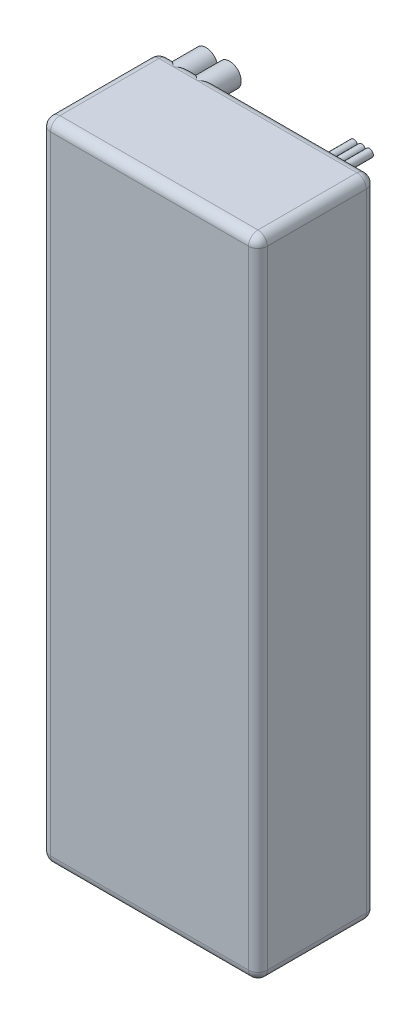
from build123d import *

# Parameters (mm, degrees)
SKETCH1_W                       = 46
SKETCH1_H                       = 137
BOSS_EXTRUDE1_DEPTH             = 25
FILLET1_R                       = 2
SKETCH2_R                       = 0.825
SKETCH2_R_2                     = 2.45
BOSS_EXTRUDE4_DEPTH             = 5
BOSS_EXTRUDE4_DIRECTION_2_REACH = 143.149


with BuildPart() as part:
    # Sketch1 → Boss-Extrude1 (new body)
    with BuildSketch(Plane.XY):
        with Locations((0, 68.5)):
            Rectangle(SKETCH1_W, SKETCH1_H)
    extrude(amount=BOSS_EXTRUDE1_DEPTH)

    # Fillet1
    fillet1_edges = [part.edges().sort_by_distance(p)[0] for p in [
        (23, 68.5, 25),
        (0, 137, 25),
        (-23, 68.5, 25),
        (0, 137, 0),
        (23, 68.5, 0),
        (0, 0, 0),
        (-23, 68.5, 0),
        (-23, 137, 12.5),
        (23, 137, 12.5),
        (23, 0, 12.5),
        (-23, 0, 12.5),
        (0, 0, 25),
    ]]
    fillet(fillet1_edges, radius=FILLET1_R)

    # Sketch2 → Boss-Extrude4 (add)
    with BuildSketch(Plane(origin=(0, 0, 0), x_dir=(-1, 0, 0), z_dir=(0, 0, -1))):
        with Locations((-16.666666667, 135)):
            Circle(SKETCH2_R)
        with Locations((-15, 135)):
            Circle(SKETCH2_R)
        with Locations((-13.333333333, 135)):
            Circle(SKETCH2_R)
        with Locations((13, 134.55)):
            Circle(SKETCH2_R_2)
        with Locations((18, 134.55)):
            Circle(SKETCH2_R_2)
    extrude(amount=BOSS_EXTRUDE4_DEPTH)

    # Sketch2 → Boss-Extrude4 direction 2 (add, up to next)
    with BuildSketch(Plane(origin=(0, 0, 0), x_dir=(-1, 0, 0), z_dir=(0, 0, -1)), mode=Mode.PRIVATE) as boss_extrude4_direction_2_sk1:
        with Locations((-16.666666667, 135)):
            Circle(SKETCH2_R)
    boss_extrude4_direction_2_tool1 = extrude(boss_extrude4_direction_2_sk1.sketch, amount=-BOSS_EXTRUDE4_DIRECTION_2_REACH, mode=Mode.PRIVATE) - part.part
    # Sketch2 → Boss-Extrude4 direction 2 (add, up to next)
    with BuildSketch(Plane(origin=(0, 0, 0), x_dir=(-1, 0, 0), z_dir=(0, 0, -1)), mode=Mode.PRIVATE) as boss_extrude4_direction_2_sk2:
        with Locations((-15, 135)):
            Circle(SKETCH2_R)
    boss_extrude4_direction_2_tool2 = extrude(boss_extrude4_direction_2_sk2.sketch, amount=-BOSS_EXTRUDE4_DIRECTION_2_REACH, mode=Mode.PRIVATE) - part.part
    # Sketch2 → Boss-Extrude4 direction 2 (add, up to next)
    with BuildSketch(Plane(origin=(0, 0, 0), x_dir=(-1, 0, 0), z_dir=(0, 0, -1)), mode=Mode.PRIVATE) as boss_extrude4_direction_2_sk3:
        with Locations((-13.333333333, 135)):
            Circle(SKETCH2_R)
    boss_extrude4_direction_2_tool3 = extrude(boss_extrude4_direction_2_sk3.sketch, amount=-BOSS_EXTRUDE4_DIRECTION_2_REACH, mode=Mode.PRIVATE) - part.part
    # Sketch2 → Boss-Extrude4 direction 2 (add, up to next)
    with BuildSketch(Plane(origin=(0, 0, 0), x_dir=(-1, 0, 0), z_dir=(0, 0, -1)), mode=Mode.PRIVATE) as boss_extrude4_direction_2_sk4:
        with Locations((13, 134.55)):
            Circle(SKETCH2_R_2)
    boss_extrude4_direction_2_tool4 = extrude(boss_extrude4_direction_2_sk4.sketch, amount=-BOSS_EXTRUDE4_DIRECTION_2_REACH, mode=Mode.PRIVATE) - part.part
    # Sketch2 → Boss-Extrude4 direction 2 (add, up to next)
    with BuildSketch(Plane(origin=(0, 0, 0), x_dir=(-1, 0, 0), z_dir=(0, 0, -1)), mode=Mode.PRIVATE) as boss_extrude4_direction_2_sk5:
        with Locations((18, 134.55)):
            Circle(SKETCH2_R_2)
    boss_extrude4_direction_2_tool5 = extrude(boss_extrude4_direction_2_sk5.sketch, amount=-BOSS_EXTRUDE4_DIRECTION_2_REACH, mode=Mode.PRIVATE) - part.part
    add(boss_extrude4_direction_2_tool1.solids().sort_by_distance((16.666667, 135, 0))[0])
    add(boss_extrude4_direction_2_tool2.solids().sort_by_distance((15, 135, 0))[0])
    add(boss_extrude4_direction_2_tool3.solids().sort_by_distance((13.333333, 135, 0))[0])
    add(boss_extrude4_direction_2_tool4.solids().sort_by_distance((-13, 134.55, 0))[0])
    add(boss_extrude4_direction_2_tool5.solids().sort_by_distance((-18, 134.55, 0))[0])


solid = part.part
